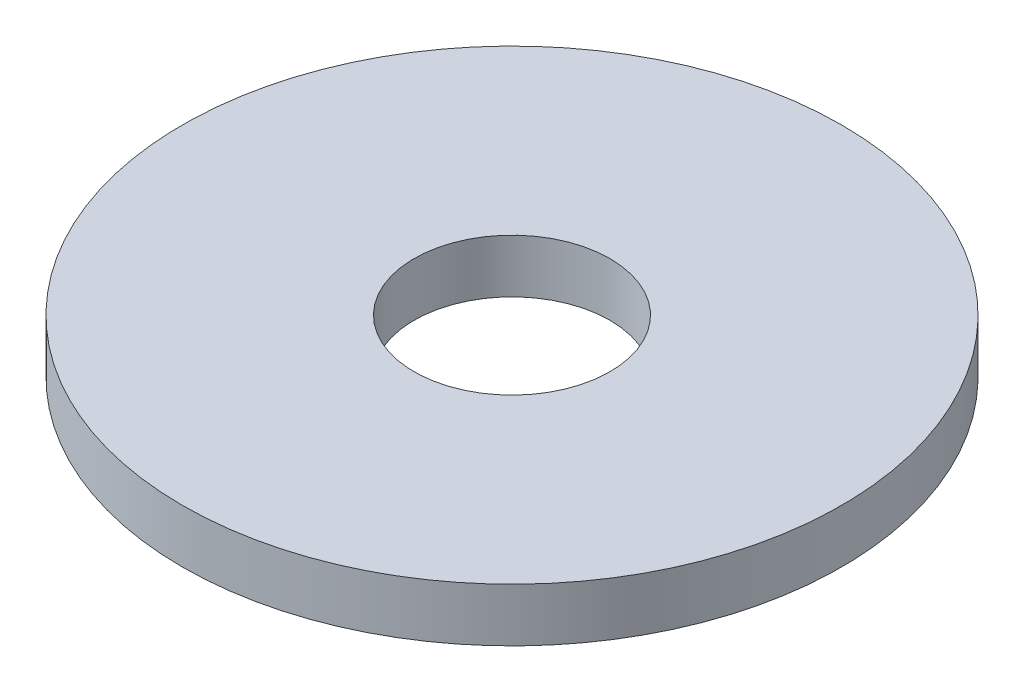
from build123d import *

# Parameters (mm, degrees)
SKETCH_2_W = 13
SKETCH_2_H = 3


with BuildPart() as part:
    # 草图2 → 旋转1 (revolve)
    with BuildSketch(Plane.XY, mode=Mode.PRIVATE) as revolve_1_sk:
        with Locations((12, 1.5)):
            Rectangle(SKETCH_2_W, SKETCH_2_H)
    revolve(revolve_1_sk.sketch.rotate(Axis((0, 0, 0), (0, 1, 0)), 90), axis=Axis((0, 0, 0), (0, 1, 0)))


solid = part.part
